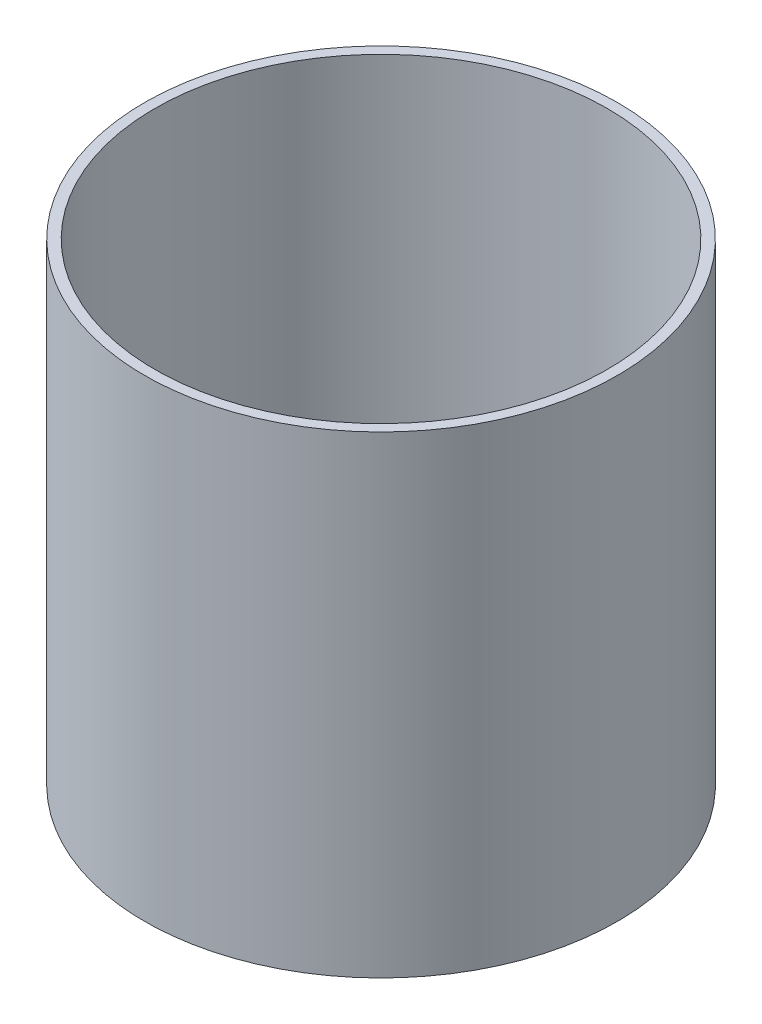
from build123d import *

# Parameters (mm, degrees)
SKETCH1_R           = 38.1
SKETCH1_R_2         = 36.449
BOSS_EXTRUDE1_DEPTH = 76.2


with BuildPart() as part:
    # Sketch1 → Boss-Extrude1 (new body)
    with BuildSketch(Plane(origin=(0, 0, 0), x_dir=(1, 0, 0), z_dir=(0, 1, 0))):
        with Locations(Location((0, 0, 0), (0, 0, 90))):
            Circle(SKETCH1_R)
        with Locations(Location((0, 0, 0), (0, 0, 90))):
            Circle(SKETCH1_R_2, mode=Mode.SUBTRACT)
    extrude(amount=BOSS_EXTRUDE1_DEPTH)


solid = part.part
